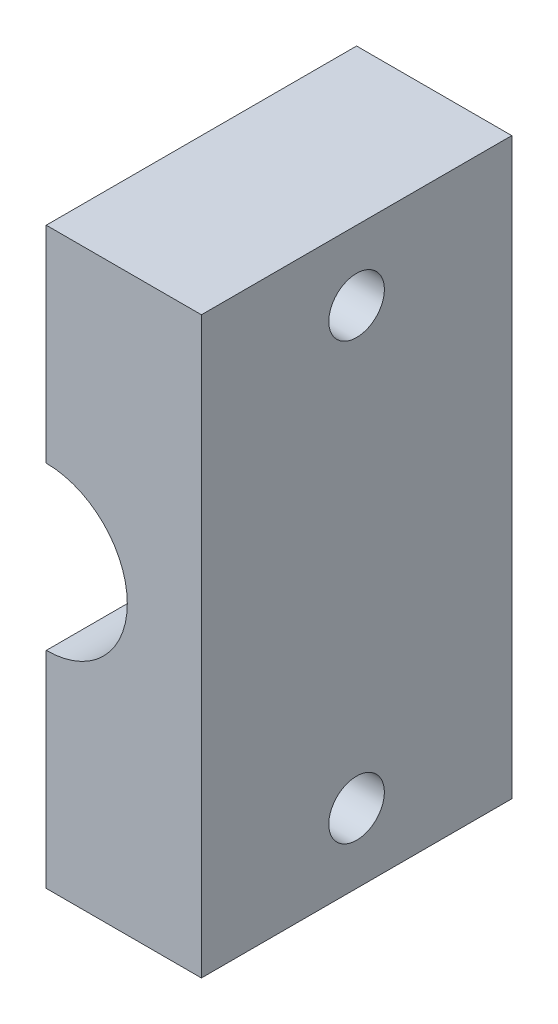
from build123d import *

# Parameters (mm, degrees)
EXTRUDE_1_DEPTH     = 2.7
SKETCH_1_4_W        = 3.35
SKETCH_1_4_H        = 12.4
EXTRUDE_2_DEPTH     = 2
EXTRUDE_START       = 2.7
SKETCH_1_5_W        = 3.35
SKETCH_1_5_H        = 12.4
EXTRUDE_3_DEPTH     = 2
SKETCH_2_R          = 1.75
CUT_EXTRUDE_1_DEPTH = 10.723810981
SKETCH_4_R          = 0.6
CUT_EXTRUDE_2_DEPTH = 9.470684742


with BuildPart() as part:
    # 草图1 → 凸台-拉伸1 (new body)
    with BuildSketch(Plane.XY):
        with BuildLine():
            Line((3.35, 6.2), (0, 6.2))
            Line((0, 6.2), (0, 3.2))
            ThreePointArc((0, 3.2), (2.2627417, 2.2627417), (3.2, 0))
            ThreePointArc((3.2, 0), (2.2627417, -2.2627417), (0, -3.2))
            Line((0, -3.2), (0, -6.2))
            Line((0, -6.2), (3.35, -6.2))
            Line((3.35, -6.2), (3.35, 6.2))
        make_face()
    extrude(amount=EXTRUDE_1_DEPTH)

    # 草图1<4> → 凸台-拉伸2 (add)
    with BuildSketch(Plane.XY):
        with Locations((1.675, 0)):
            Rectangle(SKETCH_1_4_W, SKETCH_1_4_H)
    extrude(amount=-EXTRUDE_2_DEPTH)

    # 草图1<5> → 凸台-拉伸3 (add)
    with BuildSketch(Plane.XY.offset(EXTRUDE_START)):
        with Locations((1.675, 0)):
            Rectangle(SKETCH_1_5_W, SKETCH_1_5_H)
    extrude(amount=EXTRUDE_3_DEPTH)

    # 草图2 → 切除-拉伸1 (cut, through all)
    with BuildSketch(Plane.XY.offset(4.7)):
        Circle(SKETCH_2_R)
    extrude(amount=-CUT_EXTRUDE_1_DEPTH, mode=Mode.SUBTRACT)

    # 草图4 → 切除-拉伸2 (cut, through all)
    with BuildSketch(Plane(origin=(3.35, 0, 0), x_dir=(0, 0, -1), z_dir=(1, 0, 0))):
        with Locations((-1.35, -4.7)):
            Circle(SKETCH_4_R)
        with Locations((-1.35, 4.7)):
            Circle(SKETCH_4_R)
    extrude(amount=-CUT_EXTRUDE_2_DEPTH, mode=Mode.SUBTRACT)


solid = part.part
